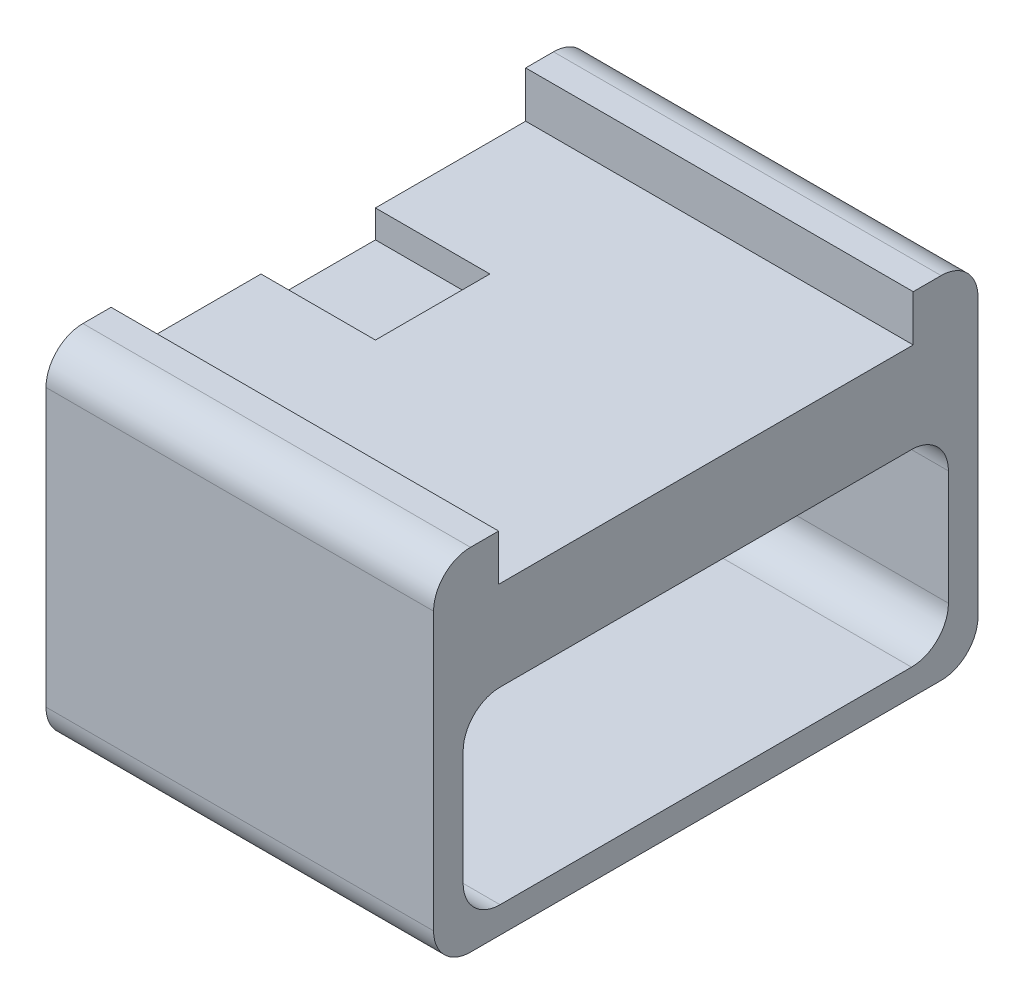
from build123d import *

# Parameters (mm, degrees)
BOSS_EXTRUDE1_DEPTH     = 21
SKETCH5_W               = 6.2
SKETCH5_H               = 6.2
CUT_EXTRUDE1_DEPTH      = 4
CUT_EXTRUDE2_DEPTH      = 28.364438602
CUT_EXTRUDE2_DEPTH_BACK = 28.364438602
SKETCH9_W               = 24.284850455
SKETCH9_H               = 22.464844075
CUT_EXTRUDE3_DEPTH      = 2.5


with BuildPart() as part:
    # Sketch3 → Boss-Extrude1 (new body)
    with BuildSketch(Plane(origin=(0, 0, 0), x_dir=(0, 0, -1), z_dir=(1, 0, 0))):
        with BuildLine():
            Line((-12.75, -9.5), (12.75, -9.5))
            ThreePointArc((12.75, -9.5), (14.164213562, -8.914213562), (14.75, -7.5))
            Line((14.75, -7.5), (14.75, 7.5))
            ThreePointArc((14.75, 7.5), (14.164213562, 8.914213562), (12.75, 9.5))
            Line((12.75, 9.5), (-12.75, 9.5))
            ThreePointArc((-12.75, 9.5), (-14.164213562, 8.914213562), (-14.75, 7.5))
            Line((-14.75, 7.5), (-14.75, -7.5))
            ThreePointArc((-14.75, -7.5), (-14.164213562, -8.914213562), (-12.75, -9.5))
        make_face()
    extrude(amount=BOSS_EXTRUDE1_DEPTH)

    # Sketch5 → Cut-Extrude1 (cut)
    with BuildSketch(Plane(origin=(0, 9.5, 0), x_dir=(1, 0, 0), z_dir=(0, 1, 0))):
        with Locations((3.1, 0)):
            Rectangle(SKETCH5_W, SKETCH5_H)
    extrude(amount=-CUT_EXTRUDE1_DEPTH, mode=Mode.SUBTRACT)

    # Sketch7 → Cut-Extrude2 (cut, two sides: drawn at the far end of the back side and taken through both)
    with BuildSketch(Plane.ZY.offset(-CUT_EXTRUDE2_DEPTH_BACK)):
        with BuildLine():
            Line((-11.147623693, -8.072928754), (11.147623693, -8.072928754))
            ThreePointArc((11.147623693, -8.072928754), (12.561837255, -7.487142316), (13.147623693, -6.072928754))
            Line((13.147623693, -6.072928754), (13.147623693, 0.135263404))
            ThreePointArc((13.147623693, 0.135263404), (12.561837255, 1.549476966), (11.147623693, 2.135263404))
            Line((11.147623693, 2.135263404), (-11.147623693, 2.135263404))
            ThreePointArc((-11.147623693, 2.135263404), (-12.561837255, 1.549476966), (-13.147623693, 0.135263404))
            Line((-13.147623693, 0.135263404), (-13.147623693, -6.072928754))
            ThreePointArc((-13.147623693, -6.072928754), (-12.561837255, -7.487142316), (-11.147623693, -8.072928754))
        make_face()
    extrude(amount=CUT_EXTRUDE2_DEPTH + CUT_EXTRUDE2_DEPTH_BACK, mode=Mode.SUBTRACT)

    # Sketch9 → Cut-Extrude3 (cut)
    with BuildSketch(Plane(origin=(0, 9.5, 0), x_dir=(1, 0, 0), z_dir=(0, 1, 0))):
        with Locations((12.142425228, 0.007615305)):
            Rectangle(SKETCH9_W, SKETCH9_H)
    extrude(amount=-CUT_EXTRUDE3_DEPTH, mode=Mode.SUBTRACT)


solid = part.part
